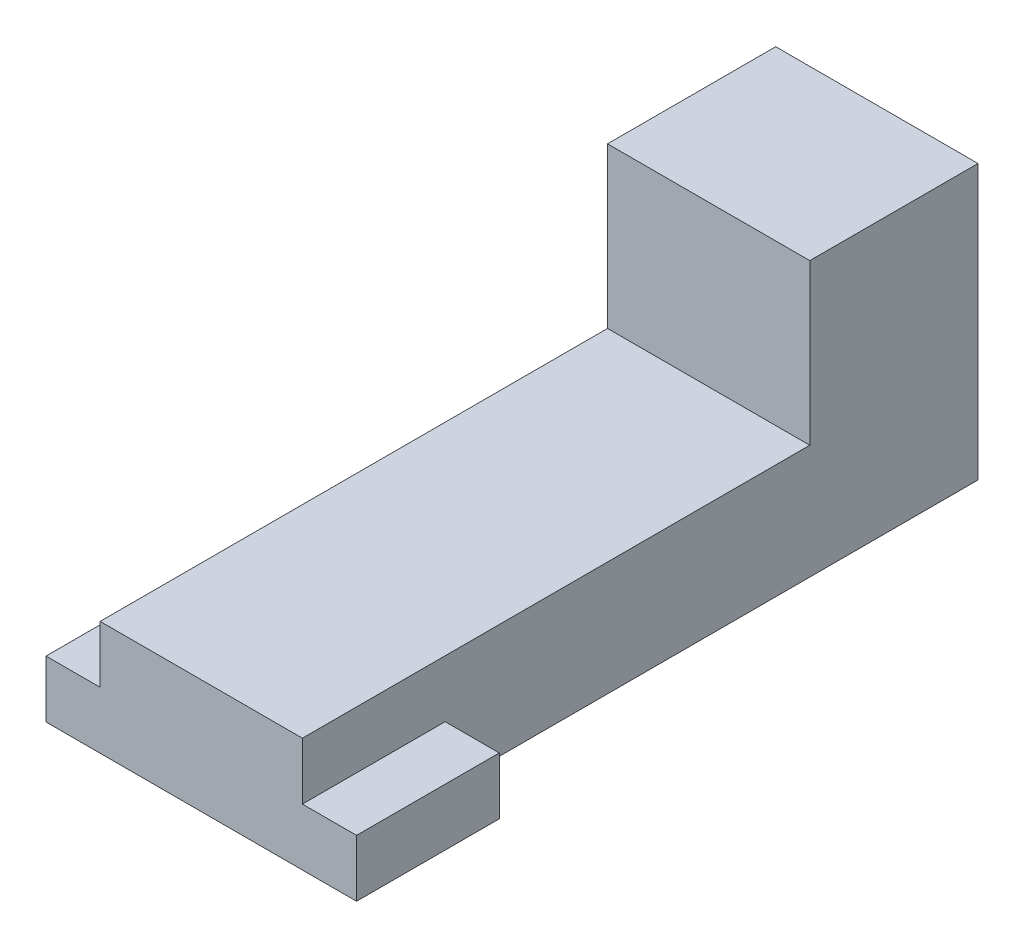
from build123d import *

# Parameters (mm, degrees)
SKETCH1_W           = 1359.59
SKETCH1_H           = 250
BOSS_EXTRUDE1_DEPTH = 625
SKETCH2_W           = 885.6
SKETCH2_H           = 500
BOSS_EXTRUDE2_DEPTH = 2957.87
SKETCH3_W           = 885.6
SKETCH3_H           = 736.48
BOSS_EXTRUDE4_DEPTH = 700


with BuildPart() as part:
    # Sketch1 → Boss-Extrude1 (new body)
    with BuildSketch(Plane.XY):
        Rectangle(SKETCH1_W, SKETCH1_H)
    extrude(amount=BOSS_EXTRUDE1_DEPTH)

    # Sketch2 → Boss-Extrude2 (add)
    with BuildSketch(Plane.XY.offset(625)):
        with Locations((0, 125)):
            Rectangle(SKETCH2_W, SKETCH2_H)
    extrude(amount=-BOSS_EXTRUDE2_DEPTH)

    # Sketch3 → Boss-Extrude4 (add)
    with BuildSketch(Plane(origin=(0, 375, 0), x_dir=(1, 0, 0), z_dir=(0, 1, 0))):
        with Locations((0, 1964.63)):
            Rectangle(SKETCH3_W, SKETCH3_H)
    extrude(amount=BOSS_EXTRUDE4_DEPTH)


solid = part.part
